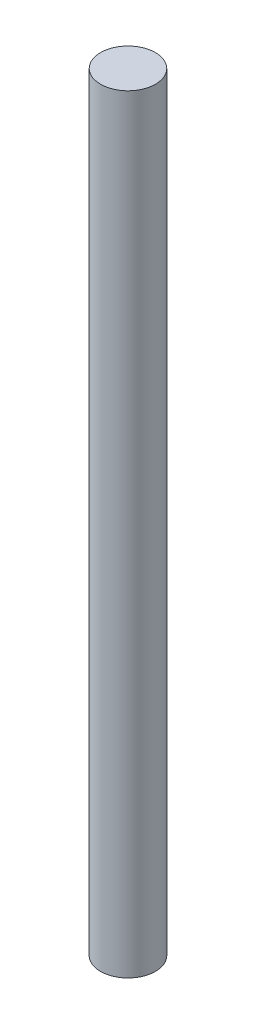
from build123d import *

# Parameters (mm, degrees)
SKETCH1_R           = 2.5
BOSS_EXTRUDE1_DEPTH = 70


with BuildPart() as part:
    # Sketch1 → Boss-Extrude1 (new body)
    with BuildSketch(Plane(origin=(0, 0, 0), x_dir=(1, 0, 0), z_dir=(0, 1, 0))):
        with Locations(Location((0, 0, 0), (0, 0, 270))):
            Circle(SKETCH1_R)
    extrude(amount=BOSS_EXTRUDE1_DEPTH)


solid = part.part
